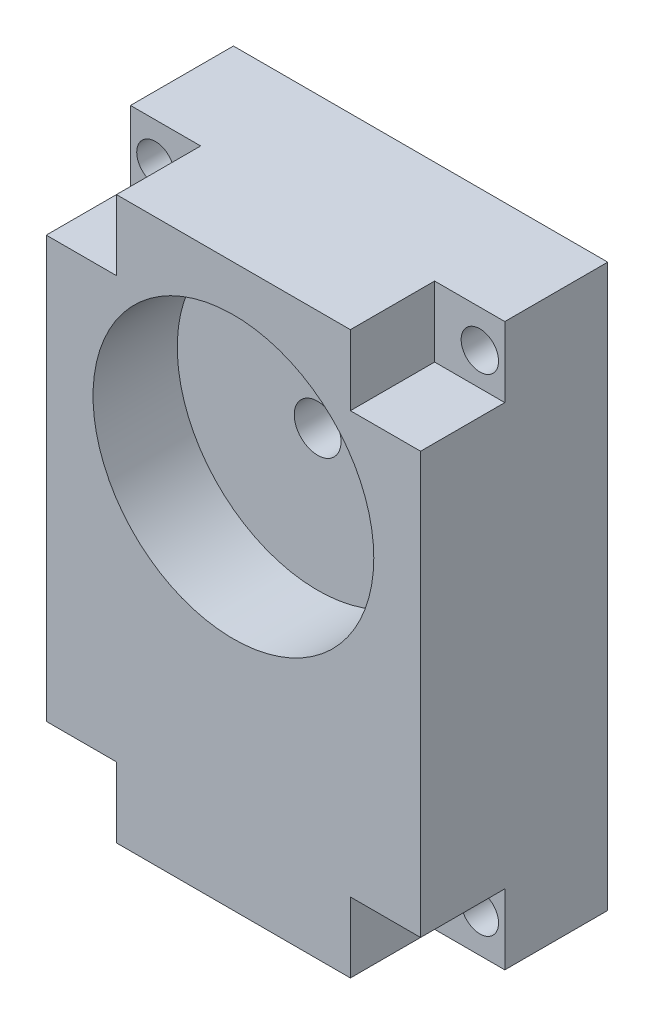
from build123d import *

# Parameters (mm, degrees)
SKETCH1_W           = 40
SKETCH1_H           = 60
BOSS_EXTRUDE1_DEPTH = 20
SKETCH2_R           = 15
CUT_EXTRUDE1_DEPTH  = 9
SKETCH3_R           = 2
CUT_EXTRUDE2_DEPTH  = 32
SKETCH4_W           = 15
SKETCH4_H           = 15
CUT_EXTRUDE3_DEPTH  = 9
SKETCH5_R           = 2.5
CUT_EXTRUDE4_DEPTH  = 11


with BuildPart() as part:
    # Sketch1 → Boss-Extrude1 (new body)
    with BuildSketch(Plane.XY):
        Rectangle(SKETCH1_W, SKETCH1_H)
    extrude(amount=BOSS_EXTRUDE1_DEPTH)

    # Sketch2 → Cut-Extrude1 (cut)
    with BuildSketch(Plane.XY.offset(20)):
        with Locations((0, 10.125)):
            Circle(SKETCH2_R)
    extrude(amount=-CUT_EXTRUDE1_DEPTH, mode=Mode.SUBTRACT)

    # Sketch3 → Cut-Extrude2 (cut)
    with BuildSketch(Plane.XY.offset(11)):
        with Locations((17.333333333, 26)):
            Circle(SKETCH3_R)
        with Locations((-17.333333333, 26)):
            Circle(SKETCH3_R)
        with Locations((17.333333333, -26)):
            Circle(SKETCH3_R)
        with Locations((-17.333333333, -26)):
            Circle(SKETCH3_R)
    extrude(amount=-CUT_EXTRUDE2_DEPTH, mode=Mode.SUBTRACT)

    # Sketch4 → Cut-Extrude3 (cut)
    with BuildSketch(Plane.XY.offset(20)):
        with Locations((-20, 30)):
            Rectangle(SKETCH4_W, SKETCH4_H)
        with Locations((20, 30)):
            Rectangle(SKETCH4_W, SKETCH4_H)
        with Locations((-20, -30)):
            Rectangle(SKETCH4_W, SKETCH4_H)
        with Locations((20, -30)):
            Rectangle(SKETCH4_W, SKETCH4_H)
    extrude(amount=-CUT_EXTRUDE3_DEPTH, mode=Mode.SUBTRACT)

    # Sketch5 → Cut-Extrude4 (cut)
    with BuildSketch(Plane.XY.offset(11)):
        with Locations((0, 10.125)):
            Circle(SKETCH5_R)
    extrude(amount=-CUT_EXTRUDE4_DEPTH, mode=Mode.SUBTRACT)


solid = part.part
